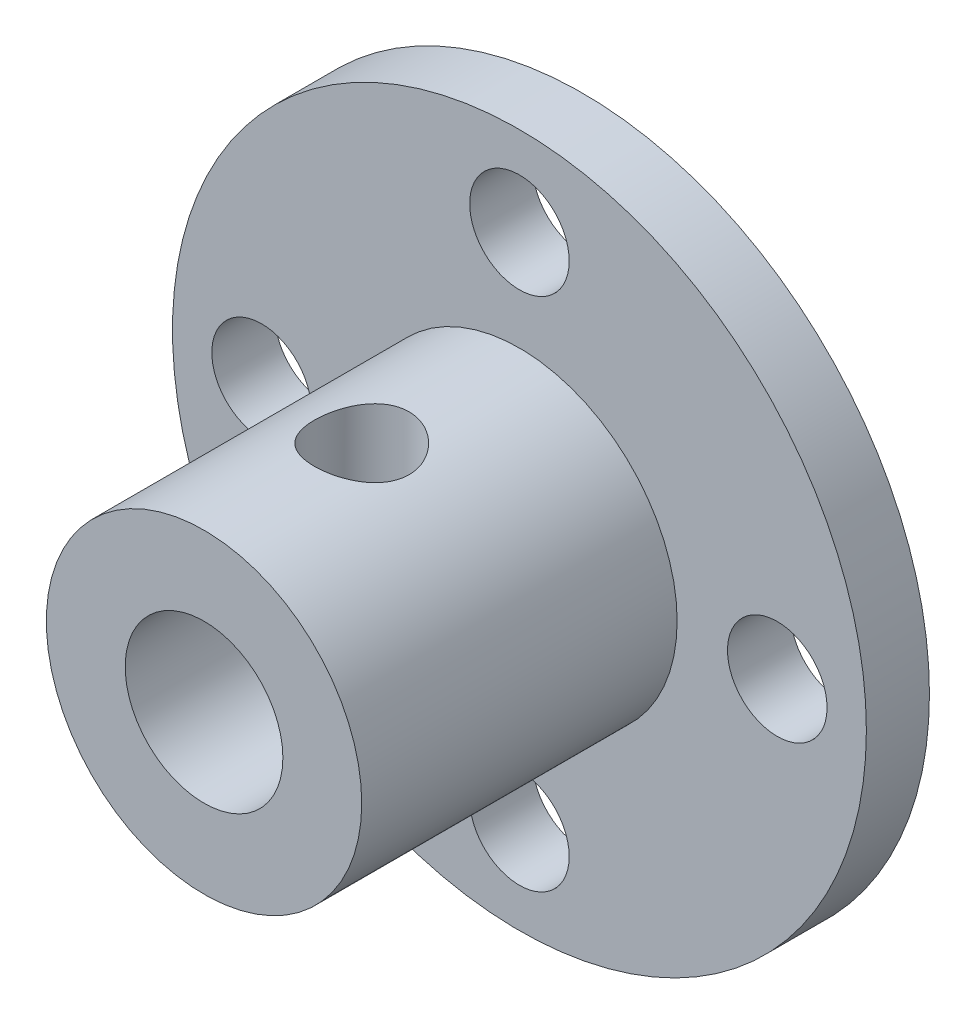
from build123d import *

# Parameters (mm, degrees)
SKETCH1_R           = 11
SKETCH1_R_2         = 2.5
SKETCH1_R_3         = 1.578075371
BOSS_EXTRUDE1_DEPTH = 2
SKETCH2_R           = 5
SKETCH2_R_2         = 2.5
BOSS_EXTRUDE2_DEPTH = 10
SKETCH3_R           = 1.5
CUT_EXTRUDE1_DEPTH  = 10.5


with BuildPart() as part:
    # Sketch1 → Boss-Extrude1 (new body)
    with BuildSketch(Plane.XY):
        Circle(SKETCH1_R)
        Circle(SKETCH1_R_2, mode=Mode.SUBTRACT)
        with Locations((-8.175, 0)):
            Circle(SKETCH1_R_3, mode=Mode.SUBTRACT)
        with Locations((0, 8.175)):
            Circle(SKETCH1_R_3, mode=Mode.SUBTRACT)
        with Locations((8.175, 0)):
            Circle(SKETCH1_R_3, mode=Mode.SUBTRACT)
        with Locations((0, -8.175)):
            Circle(SKETCH1_R_3, mode=Mode.SUBTRACT)
    extrude(amount=BOSS_EXTRUDE1_DEPTH)

    # Sketch2 → Boss-Extrude2 (add)
    with BuildSketch(Plane.XY.offset(2)):
        Circle(SKETCH2_R)
        Circle(SKETCH2_R_2, mode=Mode.SUBTRACT)
    extrude(amount=BOSS_EXTRUDE2_DEPTH)

    # Sketch3 → Cut-Extrude1 (cut, symmetric)
    with BuildSketch(Plane(origin=(0, 0, 0), x_dir=(1, 0, 0), z_dir=(0, 1, 0))):
        with Locations(Location((0, -7, 0), (0, 0, 270))):
            Circle(SKETCH3_R)
    extrude(amount=CUT_EXTRUDE1_DEPTH, both=True, mode=Mode.SUBTRACT)


solid = part.part
